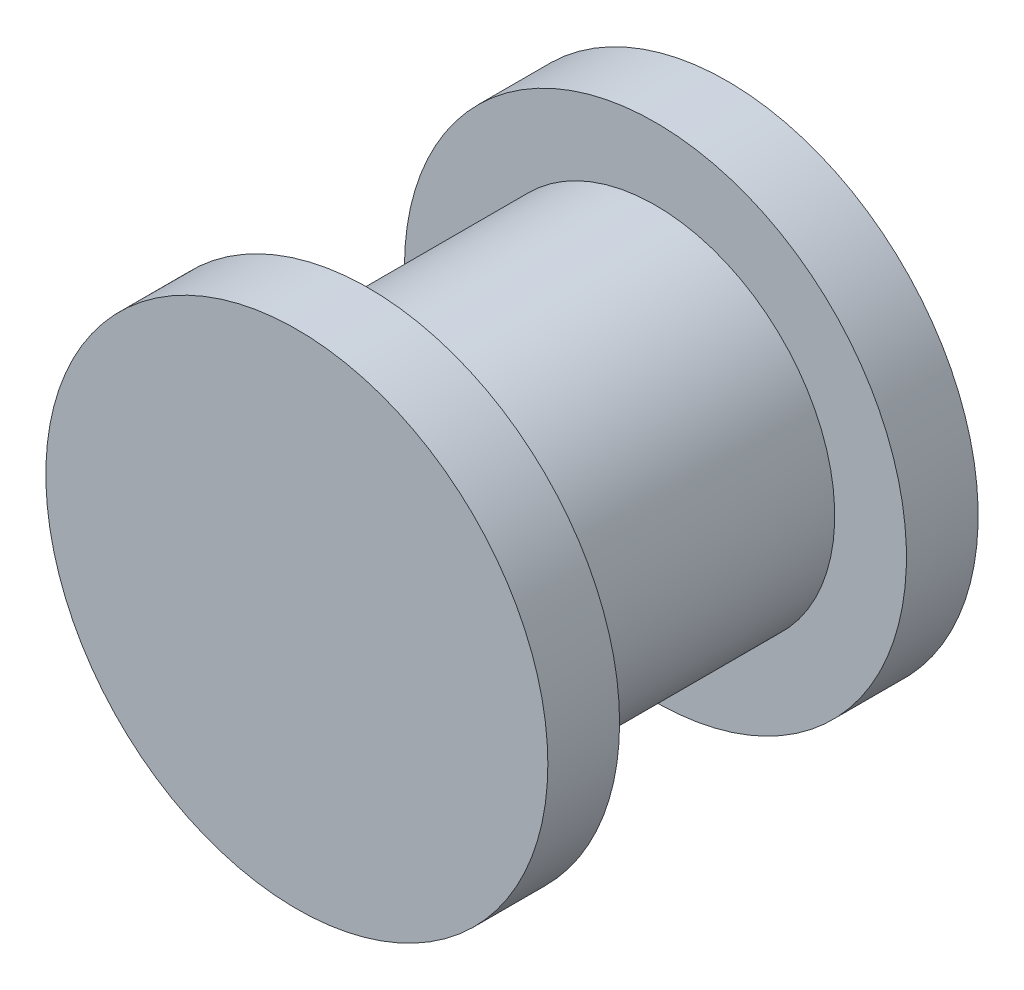
from build123d import *

# Parameters (mm, degrees)
SKETCH1_R           = 12.5
BOSS_EXTRUDE1_DEPTH = 20
SKETCH2_R           = 17.5
BOSS_EXTRUDE2_DEPTH = 5
BOSS_EXTRUDE3_START = 5
SKETCH3_R           = 17.5
BOSS_EXTRUDE3_DEPTH = 5


with BuildPart() as part:
    # Sketch1 → Boss-Extrude1 (new body)
    with BuildSketch(Plane.XY):
        Circle(SKETCH1_R)
    extrude(amount=BOSS_EXTRUDE1_DEPTH)

    # Sketch2 → Boss-Extrude2 (add)
    with BuildSketch(Plane.XY.offset(20)):
        Circle(SKETCH2_R)
    extrude(amount=BOSS_EXTRUDE2_DEPTH)

    # Sketch3 → Boss-Extrude3 (add)
    with BuildSketch(Plane(origin=(0, 0, 0), x_dir=(-1, 0, 0), z_dir=(0, 0, -1)).offset(BOSS_EXTRUDE3_START)):
        with Locations(Location((0, 0, 0), (0, 0, 180))):
            Circle(SKETCH3_R)
    extrude(amount=-BOSS_EXTRUDE3_DEPTH)


solid = part.part
